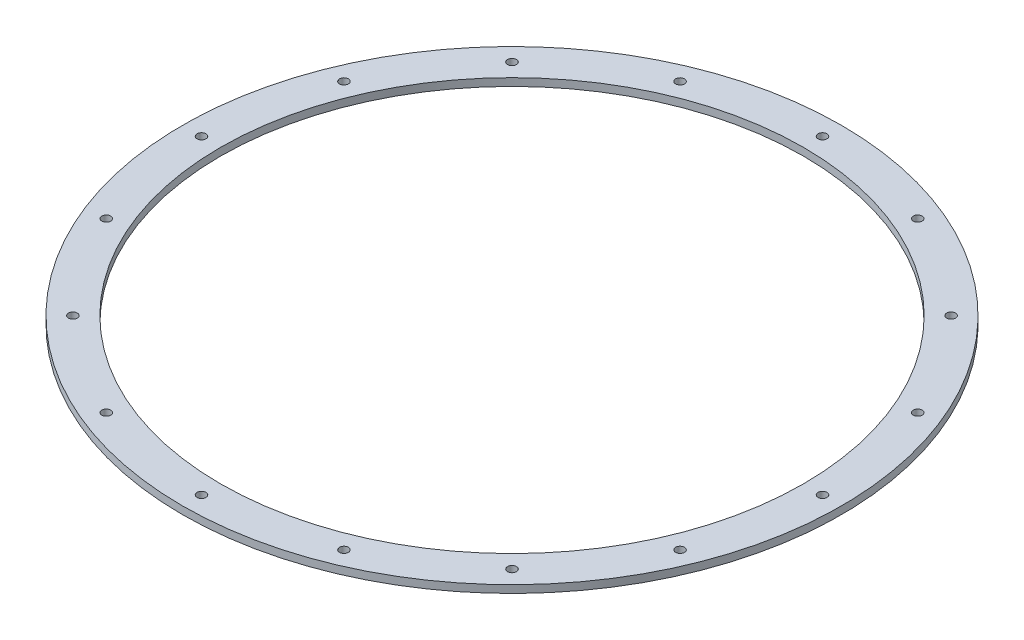
from build123d import *

# Parameters (mm, degrees)
SCHIZZO1_R                   = 259.5
SCHIZZO1_R_2                 = 229.5
SCHIZZO1_R_3                 = 3.5
ESTRUSIONE_ESTRUSIONE1_DEPTH = 3


with BuildPart() as part:
    # Schizzo1 → Estrusione-Estrusione1 (new, symmetric)
    with BuildSketch(Plane(origin=(0, 0, 0), x_dir=(1, 0, 0), z_dir=(0, 1, 0))):
        Circle(SCHIZZO1_R)
        Circle(SCHIZZO1_R_2, mode=Mode.SUBTRACT)
        with Locations((0, 244.5)):
            Circle(SCHIZZO1_R_3, mode=Mode.SUBTRACT)
        with Locations((93.566099213, 225.888545699)):
            Circle(SCHIZZO1_R_3, mode=Mode.SUBTRACT)
        with Locations((172.887608, 172.887608)):
            Circle(SCHIZZO1_R_3, mode=Mode.SUBTRACT)
        with Locations((225.888545699, 93.566099213)):
            Circle(SCHIZZO1_R_3, mode=Mode.SUBTRACT)
        with Locations((244.5, 0)):
            Circle(SCHIZZO1_R_3, mode=Mode.SUBTRACT)
        with Locations((225.888545699, -93.566099213)):
            Circle(SCHIZZO1_R_3, mode=Mode.SUBTRACT)
        with Locations((172.887608, -172.887608)):
            Circle(SCHIZZO1_R_3, mode=Mode.SUBTRACT)
        with Locations((93.566099213, -225.888545699)):
            Circle(SCHIZZO1_R_3, mode=Mode.SUBTRACT)
        with Locations((0, -244.5)):
            Circle(SCHIZZO1_R_3, mode=Mode.SUBTRACT)
        with Locations((-93.566099213, -225.888545699)):
            Circle(SCHIZZO1_R_3, mode=Mode.SUBTRACT)
        with Locations((-172.887608, -172.887608)):
            Circle(SCHIZZO1_R_3, mode=Mode.SUBTRACT)
        with Locations((-225.888545699, -93.566099213)):
            Circle(SCHIZZO1_R_3, mode=Mode.SUBTRACT)
        with Locations((-244.5, 0)):
            Circle(SCHIZZO1_R_3, mode=Mode.SUBTRACT)
        with Locations((-225.888545699, 93.566099213)):
            Circle(SCHIZZO1_R_3, mode=Mode.SUBTRACT)
        with Locations((-172.887608, 172.887608)):
            Circle(SCHIZZO1_R_3, mode=Mode.SUBTRACT)
        with Locations((-93.566099213, 225.888545699)):
            Circle(SCHIZZO1_R_3, mode=Mode.SUBTRACT)
    extrude(amount=ESTRUSIONE_ESTRUSIONE1_DEPTH, both=True)


solid = part.part
